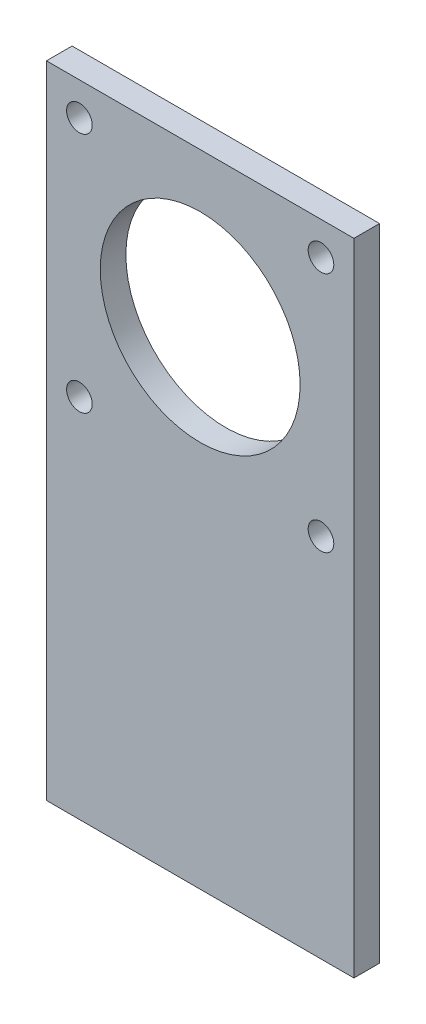
from build123d import *

# Parameters (mm, degrees)
SKETCH_1_W          = 60
SKETCH_1_H          = 125
EXTRUDE_1_DEPTH     = 5
SKETCH_4_R          = 19.5
CUT_EXTRUDE_2_DEPTH = 10
SKETCH_2_R          = 2.5
CUT_EXTRUDE_1_DEPTH = 5


with BuildPart() as part:
    # 스케치1 → 보스-돌출1 (new body)
    with BuildSketch(Plane.XY):
        Rectangle(SKETCH_1_W, SKETCH_1_H)
    extrude(amount=EXTRUDE_1_DEPTH)

    # 스케치4 → 컷-돌출2 (cut)
    with BuildSketch(Plane(origin=(0, 0, 0), x_dir=(-1, 0, 0), z_dir=(0, 0, -1))):
        with Locations((0, 32.5)):
            Circle(SKETCH_4_R)
    extrude(amount=-CUT_EXTRUDE_2_DEPTH, mode=Mode.SUBTRACT)

    # 스케치2 → 컷-돌출1 (cut)
    with BuildSketch(Plane.XY.offset(5)):
        with Locations((23.57, 56.07)):
            Circle(SKETCH_2_R)
        with Locations((23.57, 8.93)):
            Circle(SKETCH_2_R)
        with Locations((-23.57, 8.93)):
            Circle(SKETCH_2_R)
        with Locations((-23.57, 56.07)):
            Circle(SKETCH_2_R)
    extrude(amount=-CUT_EXTRUDE_1_DEPTH, mode=Mode.SUBTRACT)


solid = part.part
